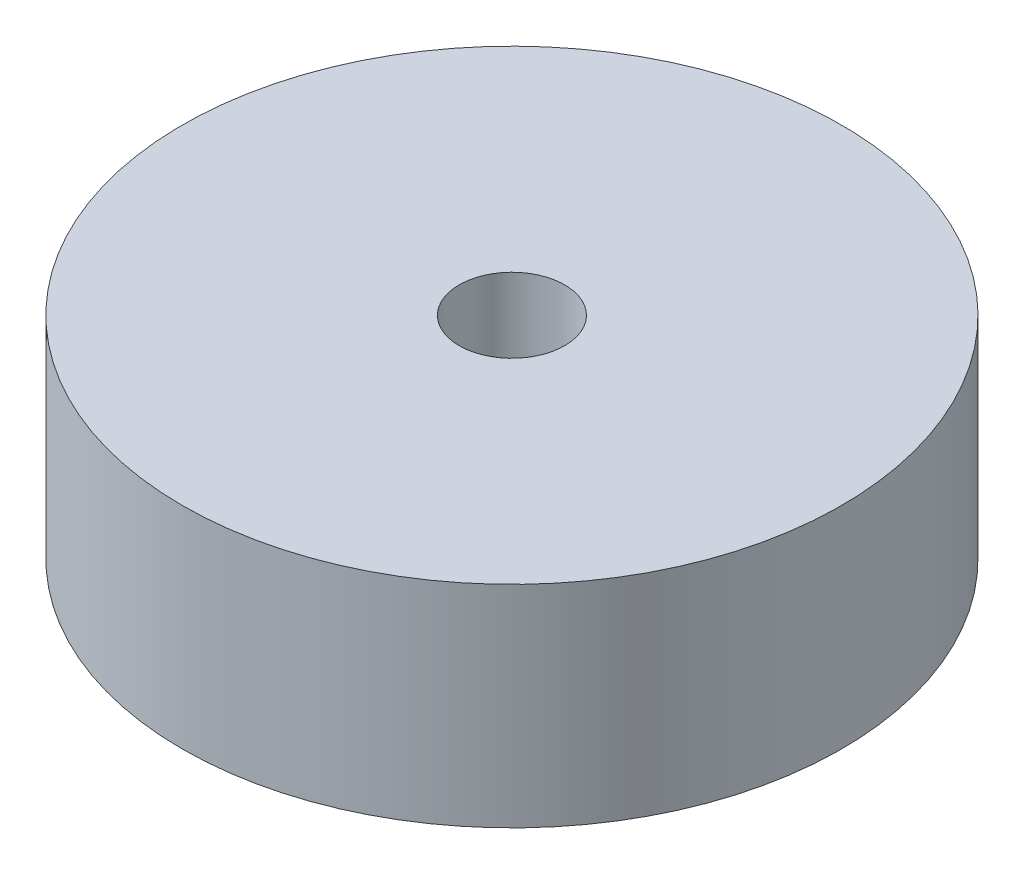
from build123d import *

# Parameters (mm, degrees)
SKETCH1_R           = 25
SKETCH1_R_2         = 4
BOSS_EXTRUDE1_DEPTH = 16


with BuildPart() as part:
    # Sketch1 → Boss-Extrude1 (new body)
    with BuildSketch(Plane(origin=(0, 0, 0), x_dir=(1, 0, 0), z_dir=(0, 1, 0))):
        with Locations(Location((0, 0, 0), (0, 0, 270))):
            Circle(SKETCH1_R)
        with Locations(Location((0, 0, 0), (0, 0, 270))):
            Circle(SKETCH1_R_2, mode=Mode.SUBTRACT)
    extrude(amount=BOSS_EXTRUDE1_DEPTH)


solid = part.part
